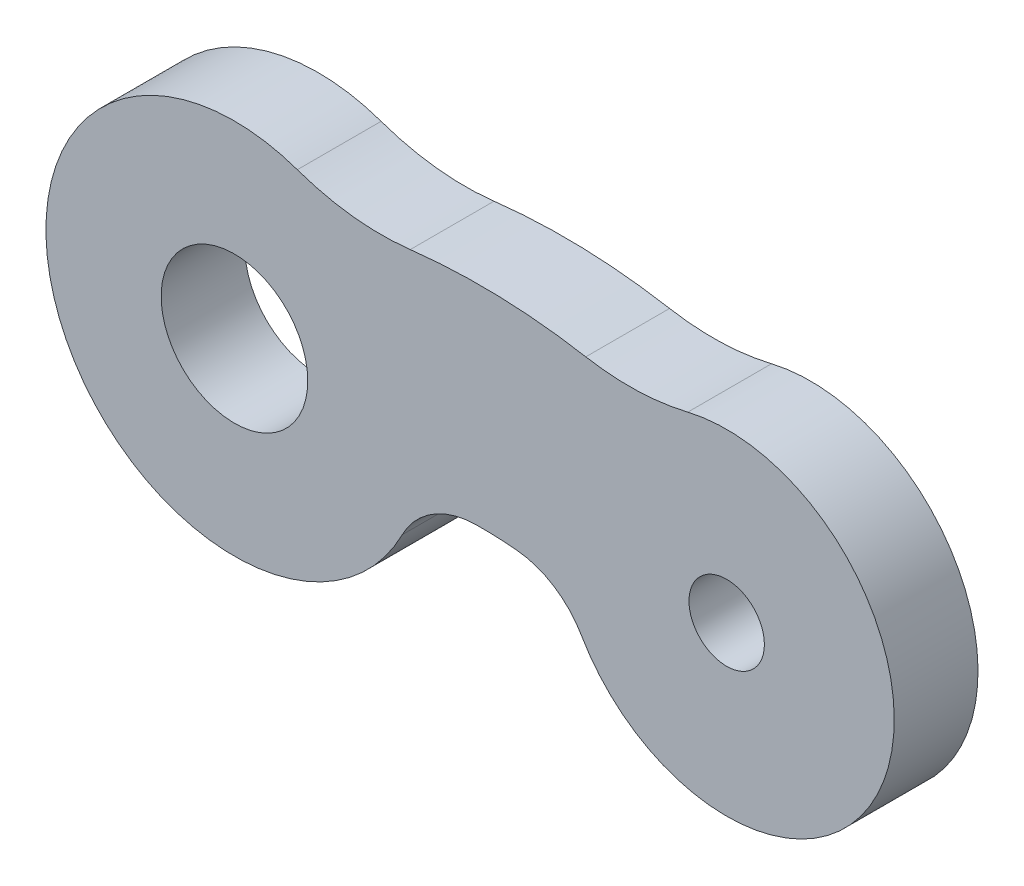
from build123d import *

# Parameters (mm, degrees)
SKETCH1_R           = 1.75
SKETCH1_R_2         = 0.9
BOSS_EXTRUDE1_DEPTH = 2


with BuildPart() as part:
    # Sketch1 → Boss-Extrude1 (new body)
    with BuildSketch(Plane.XY):
        with BuildLine():
            ThreePointArc((1.50092417, 4.24231383), (-4.181288107, -1.663379022), (4.004901939, -2.052013757))
            ThreePointArc((4.004901939, -2.052013757), (4.731552678, -1.263858953), (5.760820585, -0.96416433))
            ThreePointArc((5.760820585, -0.96416433), (6.246121173, -0.970729914), (6.730453105, -1.002072336))
            ThreePointArc((6.730453105, -1.002072336), (7.628385483, -1.309353486), (8.28357181, -1.995964829))
            ThreePointArc((8.28357181, -1.995964829), (15.423311106, -1.583283146), (10.820810187, 3.890579172))
            ThreePointArc((10.820810187, 3.890579172), (9.607869973, 3.729173943), (8.387408257, 3.817201272))
            ThreePointArc((8.387408257, 3.817201272), (6.296455304, 4.03039557), (4.196647208, 3.939060928))
            ThreePointArc((4.196647208, 3.939060928), (2.831422573, 3.936340457), (1.50092417, 4.24231383))
        make_face()
        Circle(SKETCH1_R, mode=Mode.SUBTRACT)
        with Locations((11.75, 0)):
            Circle(SKETCH1_R_2, mode=Mode.SUBTRACT)
    extrude(amount=BOSS_EXTRUDE1_DEPTH)


solid = part.part
